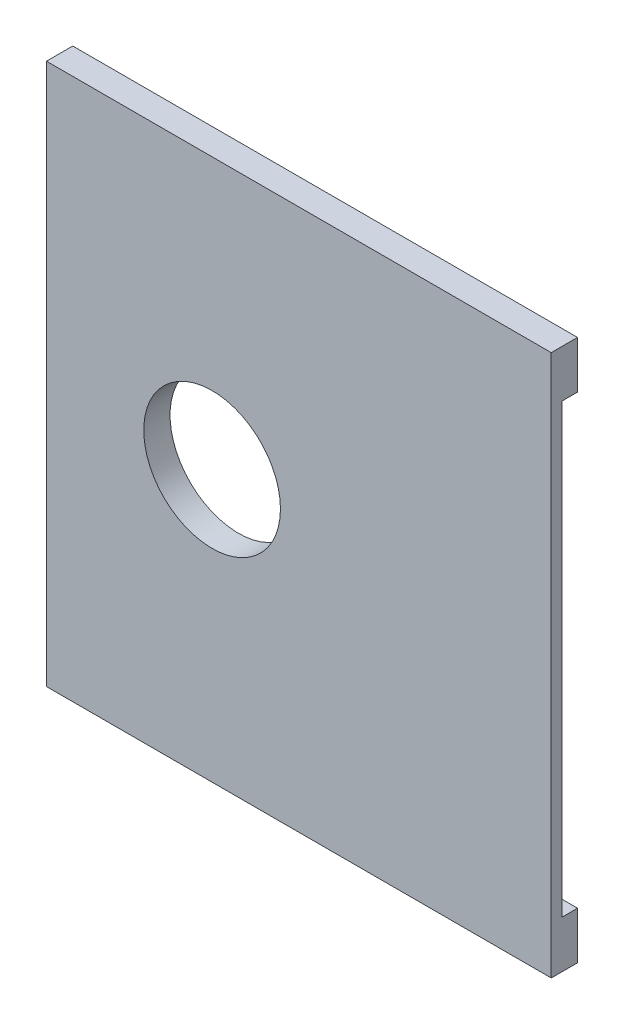
from build123d import *

# Parameters (mm, degrees)
SKETCH2_R           = 2.6
BOSS_EXTRUDE1_DEPTH = 1
CUT_EXTRUDE1_DEPTH  = 0.6


with BuildPart() as part:
    # Sketch2 → Boss-Extrude1 (new body)
    with BuildSketch(Plane.XY):
        Polygon((-6.3, 10.3), (-6.3, -10.3), (-5.3, -10.3), (6.3, -10.3), (8.1, -10.3), (12.9, -10.3), (12.9, 10.3), (8.1, 10.3), (6.3, 10.3), (-5.3, 10.3), align=None)
        Circle(SKETCH2_R, mode=Mode.SUBTRACT)
    extrude(amount=BOSS_EXTRUDE1_DEPTH)

    # Sketch3 → Cut-Extrude1 (cut)
    with BuildSketch(Plane.XY):
        Polygon((5.3, 8.5), (5.3, -8.5), (6.3, -8.5), (12.9, -8.5), (12.9, 8.5), (6.3, 8.5), align=None)
    extrude(amount=CUT_EXTRUDE1_DEPTH, mode=Mode.SUBTRACT)


solid = part.part
